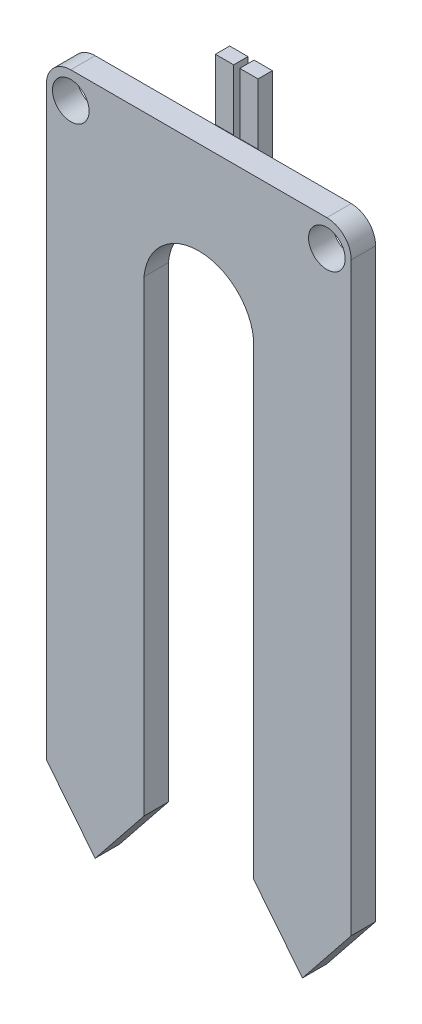
from build123d import *

# Parameters (mm, degrees)
BOSS_EXTRUDE1_DEPTH = 2
CUT_EXTRUDE1_REACH  = 44.755
SKETCH2_R           = 1.5
SKETCH3_W           = 1.5
SKETCH3_H           = 1.5
BOSS_EXTRUDE2_DEPTH = 2
SKETCH6_W           = 1.5
SKETCH6_H           = 1.17146139
BOSS_EXTRUDE5_DEPTH = 5
FILLET1_R           = 0.2
BOSS_EXTRUDE6_DEPTH = 0.3


with BuildPart() as part:
    # Sketch1 → Boss-Extrude1 (new body)
    with BuildSketch(Plane.XY):
        with BuildLine():
            Line((-31.956856316, -21.666666667), (-31.956856316, 26.333333333))
            ThreePointArc((-31.956856316, 26.333333333), (-31.371069879, 27.747546896), (-29.956856316, 28.333333333))
            Line((-29.956856316, 28.333333333), (-8.956856316, 28.333333333))
            ThreePointArc((-8.956856316, 28.333333333), (-7.542642754, 27.747546896), (-6.956856316, 26.333333333))
            Line((-6.956856316, 26.333333333), (-6.956856316, -21.666666667))
            Line((-6.956856316, -21.666666667), (-10.956856316, -26.666666667))
            Line((-10.956856316, -26.666666667), (-14.956856316, -21.666666667))
            Line((-14.956856316, -21.666666667), (-14.956856316, 16.627941441))
            ThreePointArc((-14.956856316, 16.627941441), (-19.456856316, 20.722627268), (-23.956856316, 16.627941441))
            Line((-23.956856316, 16.627941441), (-23.956856316, -21.666666667))
            Line((-23.956856316, -21.666666667), (-27.956856316, -26.666666667))
            Line((-27.956856316, -26.666666667), (-31.956856316, -21.666666667))
        make_face()
    extrude(amount=BOSS_EXTRUDE1_DEPTH)

    # Sketch2 → Cut-Extrude1 (cut, up to next)
    with BuildSketch(Plane(origin=(0, 0, 0), x_dir=(-1, 0, 0), z_dir=(0, 0, -1)), mode=Mode.PRIVATE) as cut_extrude1_sk1:
        with Locations((8.956856316, 26.146893442)):
            Circle(SKETCH2_R)
    cut_extrude1_tool1 = extrude(cut_extrude1_sk1.sketch, amount=-CUT_EXTRUDE1_REACH, mode=Mode.PRIVATE) & part.part
    # Sketch2 → Cut-Extrude1 (cut, up to next)
    with BuildSketch(Plane(origin=(0, 0, 0), x_dir=(-1, 0, 0), z_dir=(0, 0, -1)), mode=Mode.PRIVATE) as cut_extrude1_sk2:
        with Locations((29.956856316, 26.146893442)):
            Circle(SKETCH2_R)
    cut_extrude1_tool2 = extrude(cut_extrude1_sk2.sketch, amount=-CUT_EXTRUDE1_REACH, mode=Mode.PRIVATE) & part.part
    add(cut_extrude1_tool1.solids().sort_by_distance((-8.956856, 26.146893, 0))[0], mode=Mode.SUBTRACT)
    add(cut_extrude1_tool2.solids().sort_by_distance((-29.956856, 26.146893, 0))[0], mode=Mode.SUBTRACT)

    # Sketch3 → Boss-Extrude2 (add)
    with BuildSketch(Plane(origin=(0, 0, 0), x_dir=(-1, 0, 0), z_dir=(0, 0, -1))):
        with Locations((20.175136294, 26.788088759)):
            Rectangle(SKETCH3_W, SKETCH3_H)
        with Locations((18.175136294, 26.788088759)):
            Rectangle(SKETCH3_W, SKETCH3_H)
    extrude(amount=BOSS_EXTRUDE2_DEPTH)

    # Sketch6 → Boss-Extrude5 (add)
    with BuildSketch(Plane(origin=(0, 27.538088759, 0), x_dir=(1, 0, 0), z_dir=(0, 1, 0))):
        with Locations((-18.175136294, 1.414269305)):
            Rectangle(SKETCH6_W, SKETCH6_H)
        with Locations((-20.175136294, 1.414269305)):
            Rectangle(SKETCH6_W, SKETCH6_H)
    extrude(amount=BOSS_EXTRUDE5_DEPTH)

    # Fillet1
    fillet1_edges = [part.edges().sort_by_distance(p)[0] for p in [
        (-18.175136294, 26.038088759, -2),
        (-20.175136294, 26.038088759, -2),
    ]]
    fillet(fillet1_edges, radius=FILLET1_R)

    # Sketch7 → Boss-Extrude6 (add)
    with BuildSketch(Plane(origin=(0, 0, 0), x_dir=(-1, 0, 0), z_dir=(0, 0, -1))):
        with BuildLine():
            Line((8.956856316, 16.860436634), (8.956856316, 15.572285455))
            Line((8.956856316, 15.572285455), (7.994072914, 15.572285455))
            ThreePointArc((7.994072914, 15.572285455), (7.553465888, 14.508565999), (7.994072914, 13.444846543))
            Line((7.994072914, 13.444846543), (8.956856316, 13.444846543))
            Line((8.956856316, 13.444846543), (8.956856316, 9.572285455))
            Line((8.956856316, 9.572285455), (7.994072914, 9.572285455))
            ThreePointArc((7.994072914, 9.572285455), (7.553465888, 8.508565999), (7.994072914, 7.444846543))
            Line((7.994072914, 7.444846543), (8.956856316, 7.444846543))
            Line((8.956856316, 7.444846543), (8.956856316, 3.572285455))
            Line((8.956856316, 3.572285455), (7.994072914, 3.572285455))
            ThreePointArc((7.994072914, 3.572285455), (7.553465888, 2.508565999), (7.994072914, 1.444846543))
            Line((7.994072914, 1.444846543), (8.956856316, 1.444846543))
            Line((8.956856316, 1.444846543), (8.956856316, -2.427714545))
            Line((8.956856316, -2.427714545), (7.994072914, -2.427714545))
            ThreePointArc((7.994072914, -2.427714545), (7.553465888, -3.491434001), (7.994072914, -4.555153457))
            Line((7.994072914, -4.555153457), (8.956856316, -4.555153457))
            Line((8.956856316, -4.555153457), (8.956856316, -8.427714545))
            Line((8.956856316, -8.427714545), (7.994072914, -8.427714545))
            ThreePointArc((7.994072914, -8.427714545), (7.553465888, -9.491434001), (7.994072914, -10.555153457))
            Line((7.994072914, -10.555153457), (8.956856316, -10.555153457))
            Line((8.956856316, -10.555153457), (8.956856316, -14.427714545))
            Line((8.956856316, -14.427714545), (7.994072914, -14.427714545))
            ThreePointArc((7.994072914, -14.427714545), (7.553465888, -15.491434001), (7.994072914, -16.555153457))
            Line((7.994072914, -16.555153457), (8.956856316, -16.555153457))
            Line((8.956856316, -16.555153457), (8.956856316, -19.220690879))
            ThreePointArc((8.956856316, -19.220690879), (10.956856316, -21.220690879), (12.956856316, -19.220690879))
            Line((12.956856316, -19.220690879), (12.956856316, -16.555153457))
            Line((12.956856316, -16.555153457), (13.997034927, -16.555153457))
            ThreePointArc((13.997034927, -16.555153457), (14.437641952, -15.491434001), (13.997034927, -14.427714545))
            Line((13.997034927, -14.427714545), (12.956856316, -14.427714545))
            Line((12.956856316, -14.427714545), (12.956856316, -10.555153457))
            Line((12.956856316, -10.555153457), (13.997034927, -10.555153457))
            ThreePointArc((13.997034927, -10.555153457), (14.437641952, -9.491434001), (13.997034927, -8.427714545))
            Line((13.997034927, -8.427714545), (12.956856316, -8.427714545))
            Line((12.956856316, -8.427714545), (12.956856316, -4.555153457))
            Line((12.956856316, -4.555153457), (13.997034927, -4.555153457))
            ThreePointArc((13.997034927, -4.555153457), (14.437641952, -3.491434001), (13.997034927, -2.427714545))
            Line((13.997034927, -2.427714545), (12.956856316, -2.427714545))
            Line((12.956856316, -2.427714545), (12.956856316, 1.444846543))
            Line((12.956856316, 1.444846543), (13.997034927, 1.444846543))
            ThreePointArc((13.997034927, 1.444846543), (14.437641952, 2.508565999), (13.997034927, 3.572285455))
            Line((13.997034927, 3.572285455), (12.956856316, 3.572285455))
            Line((12.956856316, 3.572285455), (12.956856316, 7.444846543))
            Line((12.956856316, 7.444846543), (13.997034927, 7.444846543))
            ThreePointArc((13.997034927, 7.444846543), (14.437641952, 8.508565999), (13.997034927, 9.572285455))
            Line((13.997034927, 9.572285455), (12.956856316, 9.572285455))
            Line((12.956856316, 9.572285455), (12.956856316, 13.444846543))
            Line((12.956856316, 13.444846543), (13.997034927, 13.444846543))
            ThreePointArc((13.997034927, 13.444846543), (14.437641952, 14.508565999), (13.997034927, 15.572285455))
            Line((13.997034927, 15.572285455), (12.956856316, 15.572285455))
            Line((12.956856316, 15.572285455), (12.956856316, 16.860436634))
            Line((12.956856316, 16.860436634), (8.956856316, 16.860436634))
        make_face()
        with BuildLine():
            Line((30.997034927, -16.555153457), (29.956856316, -16.555153457))
            Line((29.956856316, -16.555153457), (29.956856316, -19.220690879))
            ThreePointArc((29.956856316, -19.220690879), (27.956856316, -21.220690879), (25.956856316, -19.220690879))
            Line((25.956856316, -19.220690879), (25.956856316, -16.555153457))
            Line((25.956856316, -16.555153457), (24.994072914, -16.555153457))
            ThreePointArc((24.994072914, -16.555153457), (24.553465888, -15.491434001), (24.994072914, -14.427714545))
            Line((24.994072914, -14.427714545), (25.956856316, -14.427714545))
            Line((25.956856316, -14.427714545), (25.956856316, -10.555153457))
            Line((25.956856316, -10.555153457), (24.994072914, -10.555153457))
            ThreePointArc((24.994072914, -10.555153457), (24.553465888, -9.491434001), (24.994072914, -8.427714545))
            Line((24.994072914, -8.427714545), (25.956856316, -8.427714545))
            Line((25.956856316, -8.427714545), (25.956856316, -4.555153457))
            Line((25.956856316, -4.555153457), (24.994072914, -4.555153457))
            ThreePointArc((24.994072914, -4.555153457), (24.553465888, -3.491434001), (24.994072914, -2.427714545))
            Line((24.994072914, -2.427714545), (25.956856316, -2.427714545))
            Line((25.956856316, -2.427714545), (25.956856316, 1.444846543))
            Line((25.956856316, 1.444846543), (24.994072914, 1.444846543))
            ThreePointArc((24.994072914, 1.444846543), (24.553465888, 2.508565999), (24.994072914, 3.572285455))
            Line((24.994072914, 3.572285455), (25.956856316, 3.572285455))
            Line((25.956856316, 3.572285455), (25.956856316, 7.444846543))
            Line((25.956856316, 7.444846543), (24.994072914, 7.444846543))
            ThreePointArc((24.994072914, 7.444846543), (24.553465888, 8.508565999), (24.994072914, 9.572285455))
            Line((24.994072914, 9.572285455), (25.956856316, 9.572285455))
            Line((25.956856316, 9.572285455), (25.956856316, 13.444846543))
            Line((25.956856316, 13.444846543), (24.994072914, 13.444846543))
            ThreePointArc((24.994072914, 13.444846543), (24.553465888, 14.508565999), (24.994072914, 15.572285455))
            Line((24.994072914, 15.572285455), (25.956856316, 15.572285455))
            Line((25.956856316, 15.572285455), (25.956856316, 16.860436634))
            Line((25.956856316, 16.860436634), (29.956856316, 16.860436634))
            Line((29.956856316, 16.860436634), (29.956856316, 15.572285455))
            Line((29.956856316, 15.572285455), (30.997034927, 15.572285455))
            ThreePointArc((30.997034927, 15.572285455), (31.437641952, 14.508565999), (30.997034927, 13.444846543))
            Line((30.997034927, 13.444846543), (29.956856316, 13.444846543))
            Line((29.956856316, 13.444846543), (29.956856316, 9.572285455))
            Line((29.956856316, 9.572285455), (30.997034927, 9.572285455))
            ThreePointArc((30.997034927, 9.572285455), (31.437641952, 8.508565999), (30.997034927, 7.444846543))
            Line((30.997034927, 7.444846543), (29.956856316, 7.444846543))
            Line((29.956856316, 7.444846543), (29.956856316, 3.572285455))
            Line((29.956856316, 3.572285455), (30.997034927, 3.572285455))
            ThreePointArc((30.997034927, 3.572285455), (31.437641952, 2.508565999), (30.997034927, 1.444846543))
            Line((30.997034927, 1.444846543), (29.956856316, 1.444846543))
            Line((29.956856316, 1.444846543), (29.956856316, -2.427714545))
            Line((29.956856316, -2.427714545), (30.997034927, -2.427714545))
            ThreePointArc((30.997034927, -2.427714545), (31.437641952, -3.491434001), (30.997034927, -4.555153457))
            Line((30.997034927, -4.555153457), (29.956856316, -4.555153457))
            Line((29.956856316, -4.555153457), (29.956856316, -8.427714545))
            Line((29.956856316, -8.427714545), (30.997034927, -8.427714545))
            ThreePointArc((30.997034927, -8.427714545), (31.437641952, -9.491434001), (30.997034927, -10.555153457))
            Line((30.997034927, -10.555153457), (29.956856316, -10.555153457))
            Line((29.956856316, -10.555153457), (29.956856316, -14.427714545))
            Line((29.956856316, -14.427714545), (30.997034927, -14.427714545))
            ThreePointArc((30.997034927, -14.427714545), (31.437641952, -15.491434001), (30.997034927, -16.555153457))
        make_face()
    extrude(amount=BOSS_EXTRUDE6_DEPTH)


solid = part.part
